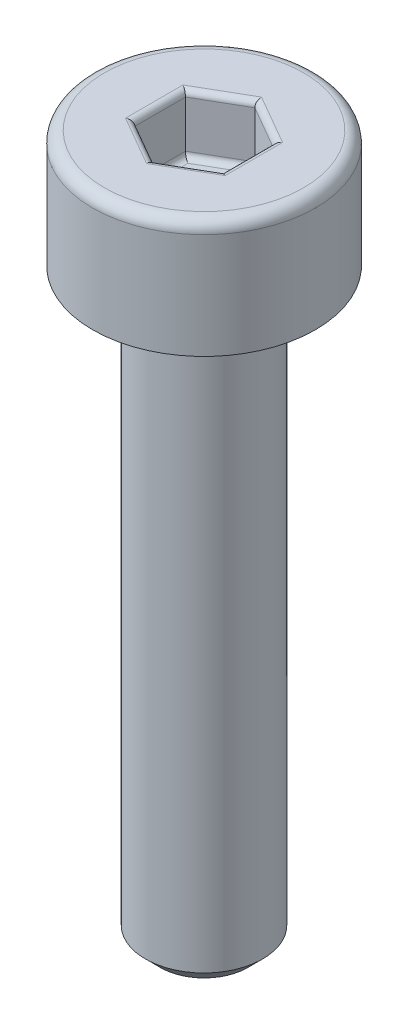
from build123d import *

# Parameters (mm, degrees)
CHAMFER1_SIZE      = 0.25
FILLET1_R          = 0.2
CUT_EXTRUDE1_DEPTH = 1
FILLET2_R          = 0.1


with BuildPart() as part:
    # Sketch1 → Revolve1 (revolve)
    with BuildSketch(Plane.XY, mode=Mode.PRIVATE) as revolve1_sk:
        Polygon((0, -12), (-1, -12), (-1, -2), (-1.9, -2), (-1.9, 0), (0, 0), align=None)
    revolve(revolve1_sk.sketch.rotate(Axis((0, 0, 0), (0, -1, 0)), 270), axis=Axis((0, 0, 0), (0, -1, 0)))

    # Chamfer1
    chamfer1_edges = [part.edges().sort_by_distance(p)[0] for p in [
        (0, -2, -1),
        (0, -12, -1),
    ]]
    chamfer(chamfer1_edges, length=CHAMFER1_SIZE)

    # Fillet1
    fillet1_edges = [part.edges().sort_by_distance(p)[0] for p in [
        (0, 0, -1.9),
    ]]
    fillet(fillet1_edges, radius=FILLET1_R)

    # Sketch2 → Cut-Extrude1 (cut)
    with BuildSketch(Plane(origin=(0, 0, 0), x_dir=(1, 0, 0), z_dir=(0, 1, 0))):
        Polygon((0, 0.866025404), (-0.75, 0.433012702), (-0.75, -0.433012702), (0, -0.866025404), (0.75, -0.433012702), (0.75, 0.433012702), align=None)
    extrude(amount=-CUT_EXTRUDE1_DEPTH, mode=Mode.SUBTRACT)

    # Fillet2
    fillet2_edges = [part.edges().sort_by_distance(p)[0] for p in [
        (0.375, -1, -0.649519053),
        (0.75, -1, 0),
        (0.375, -1, 0.649519053),
        (-0.375, -1, 0.649519053),
        (-0.75, -1, 0),
        (-0.375, -1, -0.649519053),
        (0.375, 0, -0.649519053),
        (-0.375, 0, -0.649519053),
        (-0.75, 0, 0),
        (-0.375, 0, 0.649519053),
        (0.375, 0, 0.649519053),
        (0.75, 0, 0),
    ]]
    fillet(fillet2_edges, radius=FILLET2_R)


solid = part.part
